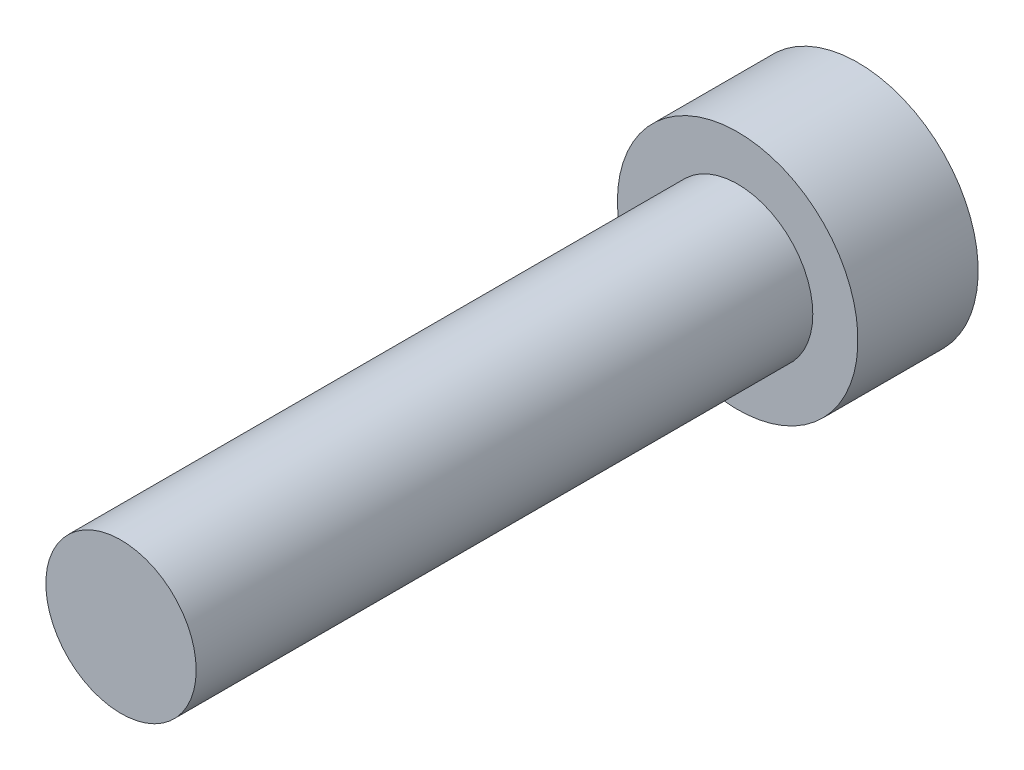
from build123d import *

# Parameters (mm, degrees)
SKETCH1_R           = 2.5
BOSS_EXTRUDE1_DEPTH = 20.51045
SKETCH2_R           = 4
BOSS_EXTRUDE2_DEPTH = 4
CUT_EXTRUDE1_DEPTH  = 2


with BuildPart() as part:
    # Sketch1 → Boss-Extrude1 (new body)
    with BuildSketch(Plane.XY):
        Circle(SKETCH1_R)
    extrude(amount=BOSS_EXTRUDE1_DEPTH)

    # Sketch2 → Boss-Extrude2 (add)
    with BuildSketch(Plane(origin=(0, 0, 0), x_dir=(-1, 0, 0), z_dir=(0, 0, -1))):
        Circle(SKETCH2_R)
    extrude(amount=BOSS_EXTRUDE2_DEPTH)

    # Sketch3 → Cut-Extrude1 (cut)
    with BuildSketch(Plane(origin=(0, 0, -4), x_dir=(-1, 0, 0), z_dir=(0, 0, -1))):
        Polygon((-0.588508987, 3.347324285), (-3.193122359, 1.16399841), (-2.604613372, -2.183325875), (0.588508987, -3.347324285), (3.193122359, -1.16399841), (2.604613372, 2.183325875), align=None)
    extrude(amount=-CUT_EXTRUDE1_DEPTH, mode=Mode.SUBTRACT)


solid = part.part
